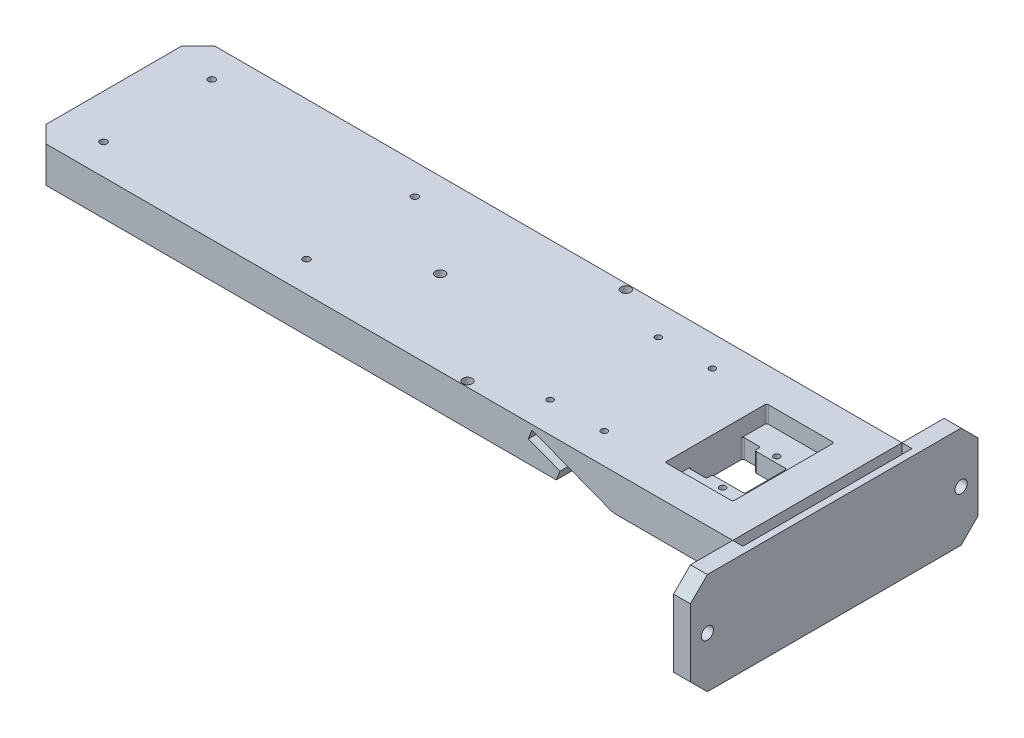
from build123d import *

# Parameters (mm, degrees)
BOSS_EXTRUDE1_DEPTH = 50
SKETCH3_W           = 85
SKETCH3_H           = 30
SKETCH3_R           = 1.8
BOSS_EXTRUDE2_DEPTH = 5
SKETCH4_W           = 50
SKETCH4_H           = 30
CUT_EXTRUDE1_DEPTH  = 3
SKETCH5_R           = 0.9
SKETCH5_R_2         = 1.4
SKETCH5_W           = 20
SKETCH5_H           = 30
CUT_EXTRUDE2_DEPTH  = 5
SKETCH7_W           = 9.5
SKETCH7_H           = 12.5
SKETCH7_R           = 0.9
CUT_EXTRUDE4_DEPTH  = 5.601482559
SKETCH8_R           = 1
CUT_EXTRUDE5_DEPTH  = 10.601482559
FILLET2_R           = 0.5
CHAMFER1_SIZE       = 5
FILLET1_R           = 5
CHAMFER2_SIZE       = 5


with BuildPart() as part:
    # Sketch1 → Boss-Extrude1 (new body)
    with BuildSketch(Plane.XY):
        Polygon((-9.335804265, 3.583679495), (0, 0), (14.59236096, -5.601482559), (45, -5.601482559), (45, -25), (50, -25), (50, 5), (0, 5), (-18, 5), (-158, 5), (-158, -5.601482559), (-2.150207697, -5.601482559), (-1.075103849, -2.800741279), (-10.410908114, 0.782938216), align=None)
    extrude(amount=BOSS_EXTRUDE1_DEPTH)

    # Sketch5 → Cut-Extrude2 (cut)
    with BuildSketch(Plane(origin=(0, 5, 0), x_dir=(1, 0, 0), z_dir=(0, 1, 0))):
        with Locations(Location((3, -9, 0), (0, 0, 180))):
            Circle(SKETCH5_R)
        with Locations(Location((-13, -9, 0), (0, 0, 180))):
            Circle(SKETCH5_R)
        with Locations(Location((-13, -41, 0), (0, 0, 180))):
            Circle(SKETCH5_R)
        with Locations(Location((3, -41, 0), (0, 0, 180))):
            Circle(SKETCH5_R)
        with Locations(Location((-30, -1.6, 0), (0, 0, 180))):
            Circle(SKETCH5_R_2)
        with Locations(Location((-30, -48.4, 0), (0, 0, 180))):
            Circle(SKETCH5_R_2)
        with Locations(Location((-61.5, -25, 0), (0, 0, 180))):
            Circle(SKETCH5_R_2)
        with Locations((30, -25)):
            Rectangle(SKETCH5_W, SKETCH5_H)
    extrude(amount=-CUT_EXTRUDE2_DEPTH, mode=Mode.SUBTRACT)

    # Sketch7 → Cut-Extrude4 (cut)
    with BuildSketch(Plane(origin=(0, 0, 0), x_dir=(1, 0, 0), z_dir=(0, 1, 0))):
        Polygon((25.25, -31.25), (25.25, -18.75), (25.25, -17), (20, -17), (20, -33), (25.25, -33), align=None)
        with Locations((30, -25)):
            Rectangle(SKETCH7_W, SKETCH7_H)
        with Locations(Location((30, -17, 0), (0, 0, 270))):
            Circle(SKETCH7_R)
        with Locations(Location((30, -33, 0), (0, 0, 270))):
            Circle(SKETCH7_R)
    extrude(amount=-CUT_EXTRUDE4_DEPTH, mode=Mode.SUBTRACT)

    # Sketch8 → Cut-Extrude5 (cut)
    with BuildSketch(Plane(origin=(0, 5, 0), x_dir=(1, 0, 0), z_dir=(0, 1, 0))):
        with Locations(Location((-85, -41, 0), (0, 0, 180))):
            Circle(SKETCH8_R)
        with Locations(Location((-85, -9, 0), (0, 0, 180))):
            Circle(SKETCH8_R)
        with Locations(Location((-145, -9, 0), (0, 0, 180))):
            Circle(SKETCH8_R)
        with Locations(Location((-145, -41, 0), (0, 0, 180))):
            Circle(SKETCH8_R)
    extrude(amount=-CUT_EXTRUDE5_DEPTH, mode=Mode.SUBTRACT)

    # Fillet2
    fillet2_edges = [part.edges().sort_by_distance(p)[0] for p in [
        (25.25, -2.800741279, 31.25),
        (34.75, -2.800741279, 31.25),
        (34.75, -2.800741279, 18.75),
        (25.25, -2.800741279, 18.75),
        (25.25, -2.800741279, 17),
        (20, -2.800741279, 17),
        (20, -2.800741279, 33),
        (25.25, -2.800741279, 33),
        (40, 2.5, 10),
        (40, 2.5, 40),
        (20, 2.5, 40),
        (20, 2.5, 10),
    ]]
    fillet(fillet2_edges, radius=FILLET2_R)

    # Fillet1
    fillet1_edges = [part.edges().sort_by_distance(p)[0] for p in [
        (45, -5.601482559, 25),
        (14.59236096, -5.601482559, 25),
    ]]
    fillet(fillet1_edges, radius=FILLET1_R)

    # Chamfer2
    chamfer2_edges = [part.edges().sort_by_distance(p)[0] for p in [
        (-158, -0.300741279, 0),
        (-158, -0.300741279, 50),
    ]]
    chamfer(chamfer2_edges, length=CHAMFER2_SIZE)


with BuildPart() as body_2:
    # Sketch3 → Boss-Extrude2 (new body)
    with BuildSketch(Plane(origin=(50, 0, 0), x_dir=(0, 0, -1), z_dir=(1, 0, 0))):
        with Locations((-25, -10)):
            Rectangle(SKETCH3_W, SKETCH3_H)
        with Locations(Location((-62.5, -10, 0), (0, 0, 90))):
            Circle(SKETCH3_R, mode=Mode.SUBTRACT)
        with Locations(Location((12.5, -10, 0), (0, 0, 90))):
            Circle(SKETCH3_R, mode=Mode.SUBTRACT)
    extrude(amount=BOSS_EXTRUDE2_DEPTH)

    # Sketch4 → Cut-Extrude1 (cut)
    with BuildSketch(Plane.ZY.offset(-50)):
        with Locations((25, -10)):
            Rectangle(SKETCH4_W, SKETCH4_H)
    extrude(amount=-CUT_EXTRUDE1_DEPTH, mode=Mode.SUBTRACT)

    # Chamfer1
    chamfer1_edges = [body_2.edges().sort_by_distance(p)[0] for p in [
        (52.5, 5, 67.5),
        (52.5, 5, -17.5),
        (52.5, -25, -17.5),
        (52.5, -25, 67.5),
    ]]
    chamfer(chamfer1_edges, length=CHAMFER1_SIZE)


solid = Compound([part.part, body_2.part])
